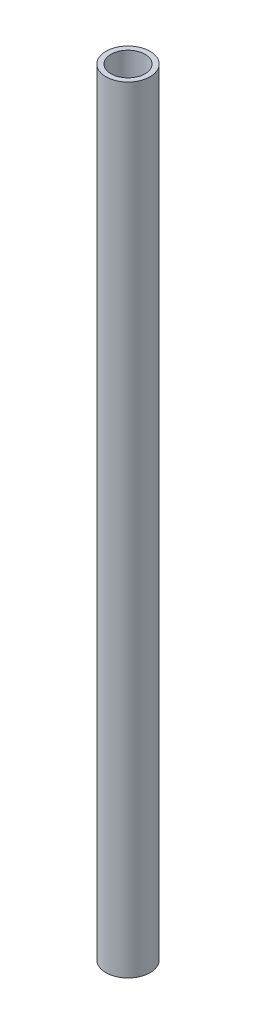
from build123d import *

# Parameters (mm, degrees)
SKETCH1_R           = 6.5
SKETCH1_R_2         = 3.5
BOSS_EXTRUDE1_DEPTH = 228.4
SKETCH2_R           = 5
CUT_EXTRUDE1_DEPTH  = 31
CUT_EXTRUDE2_START  = -197.4
SKETCH2_2_R         = 5
CUT_EXTRUDE2_DEPTH  = 31


with BuildPart() as part:
    # Sketch1 → Boss-Extrude1 (new body)
    with BuildSketch(Plane(origin=(0, 0, 0), x_dir=(1, 0, 0), z_dir=(0, 1, 0))):
        with Locations(Location((0, 0, 0), (0, 0, 270))):
            Circle(SKETCH1_R)
        with Locations(Location((0, 0, 0), (0, 0, 270))):
            Circle(SKETCH1_R_2, mode=Mode.SUBTRACT)
    extrude(amount=BOSS_EXTRUDE1_DEPTH)

    # Sketch2 → Cut-Extrude1 (cut)
    with BuildSketch(Plane(origin=(0, 228.4, 0), x_dir=(1, 0, 0), z_dir=(0, 1, 0))):
        with Locations(Location((0, 0, 0), (0, 0, 270))):
            Circle(SKETCH2_R)
    extrude(amount=-CUT_EXTRUDE1_DEPTH, mode=Mode.SUBTRACT)

    # Sketch2<2> → Cut-Extrude2 (cut)
    with BuildSketch(Plane(origin=(0, 228.4, 0), x_dir=(1, 0, 0), z_dir=(0, 1, 0)).offset(CUT_EXTRUDE2_START)):
        with Locations(Location((0, 0, 0), (0, 0, 270))):
            Circle(SKETCH2_2_R)
    extrude(amount=-CUT_EXTRUDE2_DEPTH, mode=Mode.SUBTRACT)


solid = part.part
